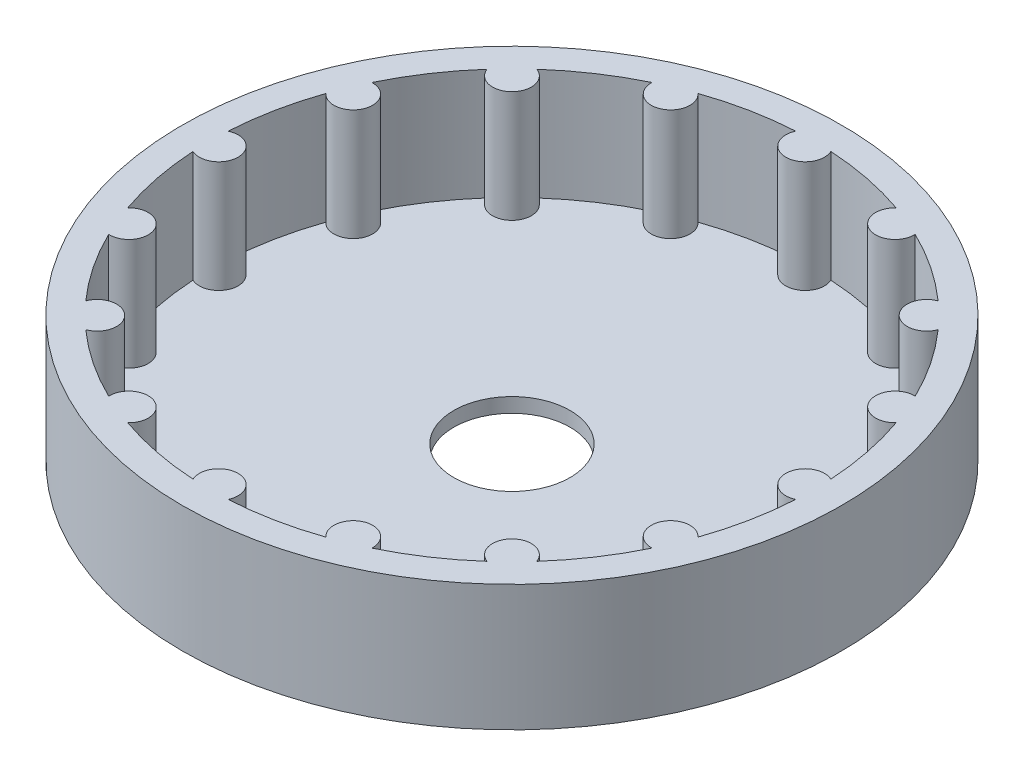
from build123d import *

# Parameters (mm, degrees)
SKETCH1_R           = 68
BOSS_EXTRUDE3_DEPTH = 23
BOSS_EXTRUDE4_START = -3
SKETCH1_6_R         = 68
SKETCH1_6_R_2       = 12
BOSS_EXTRUDE4_DEPTH = 3


with BuildPart() as part:
    # Sketch1 → Boss-Extrude3 (new body)
    with BuildSketch(Plane(origin=(0, 0, 0), x_dir=(1, 0, 0), z_dir=(0, 1, 0))):
        Circle(SKETCH1_R)
        with BuildLine():
            ThreePointArc((-3.63159136, 62.176765992), (0, 56.5), (3.63159136, 62.176765992))
            ThreePointArc((3.63159136, 62.176765992), (12.15075821, 61.085986608), (20.438865295, 58.833591344))
            ThreePointArc((20.438865295, 58.833591344), (21.621613929, 52.199193587), (27.149171151, 56.054091651))
            ThreePointArc((27.149171151, 56.054091651), (34.602431839, 51.786198893), (41.397689987, 46.533535742))
            ThreePointArc((41.397689987, 46.533535742), (39.951533137, 39.951533137), (46.533535742, 41.397689987))
            ThreePointArc((46.533535742, 41.397689987), (51.786198893, 34.602431839), (56.054091651, 27.149171151))
            ThreePointArc((56.054091651, 27.149171151), (52.199193587, 21.621613929), (58.833591344, 20.438865295))
            ThreePointArc((58.833591344, 20.438865295), (61.085986608, 12.15075821), (62.176765992, 3.63159136))
            ThreePointArc((62.176765992, 3.63159136), (56.5, 0), (62.176765992, -3.63159136))
            ThreePointArc((62.176765992, -3.63159136), (61.085986608, -12.15075821), (58.833591344, -20.438865295))
            ThreePointArc((58.833591344, -20.438865295), (52.199193587, -21.621613929), (56.054091651, -27.149171151))
            ThreePointArc((56.054091651, -27.149171151), (51.786198893, -34.602431839), (46.533535742, -41.397689987))
            ThreePointArc((46.533535742, -41.397689987), (39.951533137, -39.951533137), (41.397689987, -46.533535742))
            ThreePointArc((41.397689987, -46.533535742), (34.602431839, -51.786198893), (27.149171151, -56.054091651))
            ThreePointArc((27.149171151, -56.054091651), (21.621613929, -52.199193587), (20.438865295, -58.833591344))
            ThreePointArc((20.438865295, -58.833591344), (12.15075821, -61.085986608), (3.631591361, -62.176765992))
            ThreePointArc((3.631591361, -62.176765992), (0, -56.5), (-3.63159136, -62.176765992))
            ThreePointArc((-3.63159136, -62.176765992), (-12.15075821, -61.085986608), (-20.438865295, -58.833591344))
            ThreePointArc((-20.438865295, -58.833591344), (-21.621613929, -52.199193587), (-27.149171151, -56.054091651))
            ThreePointArc((-27.149171151, -56.054091651), (-34.602431839, -51.786198893), (-41.397689987, -46.533535742))
            ThreePointArc((-41.397689987, -46.533535742), (-39.951533137, -39.951533137), (-46.533535742, -41.397689987))
            ThreePointArc((-46.533535742, -41.397689987), (-51.786198893, -34.602431839), (-56.054091651, -27.149171151))
            ThreePointArc((-56.054091651, -27.149171151), (-52.199193587, -21.621613929), (-58.833591344, -20.438865295))
            ThreePointArc((-58.833591344, -20.438865295), (-61.085986608, -12.15075821), (-62.176765992, -3.63159136))
            ThreePointArc((-62.176765992, -3.63159136), (-56.5, 0), (-62.176765992, 3.63159136))
            ThreePointArc((-62.176765992, 3.63159136), (-61.085986608, 12.15075821), (-58.833591344, 20.438865295))
            ThreePointArc((-58.833591344, 20.438865295), (-52.199193587, 21.621613929), (-56.054091651, 27.149171151))
            ThreePointArc((-56.054091651, 27.149171151), (-51.786198893, 34.602431839), (-46.533535742, 41.397689987))
            ThreePointArc((-46.533535742, 41.397689987), (-39.951533137, 39.951533137), (-41.397689987, 46.533535742))
            ThreePointArc((-41.397689987, 46.533535742), (-34.602431839, 51.786198893), (-27.149171151, 56.054091651))
            ThreePointArc((-27.149171151, 56.054091651), (-21.621613929, 52.199193587), (-20.438865295, 58.833591344))
            ThreePointArc((-20.438865295, 58.833591344), (-12.15075821, 61.085986608), (-3.63159136, 62.176765992))
        make_face(mode=Mode.SUBTRACT)
    extrude(amount=BOSS_EXTRUDE3_DEPTH)

    # Sketch1<6> → Boss-Extrude4 (add)
    with BuildSketch(Plane(origin=(0, 0, 0), x_dir=(1, 0, 0), z_dir=(0, 1, 0)).offset(BOSS_EXTRUDE4_START)):
        Circle(SKETCH1_6_R)
        Circle(SKETCH1_6_R_2, mode=Mode.SUBTRACT)
    extrude(amount=BOSS_EXTRUDE4_DEPTH)


solid = part.part
